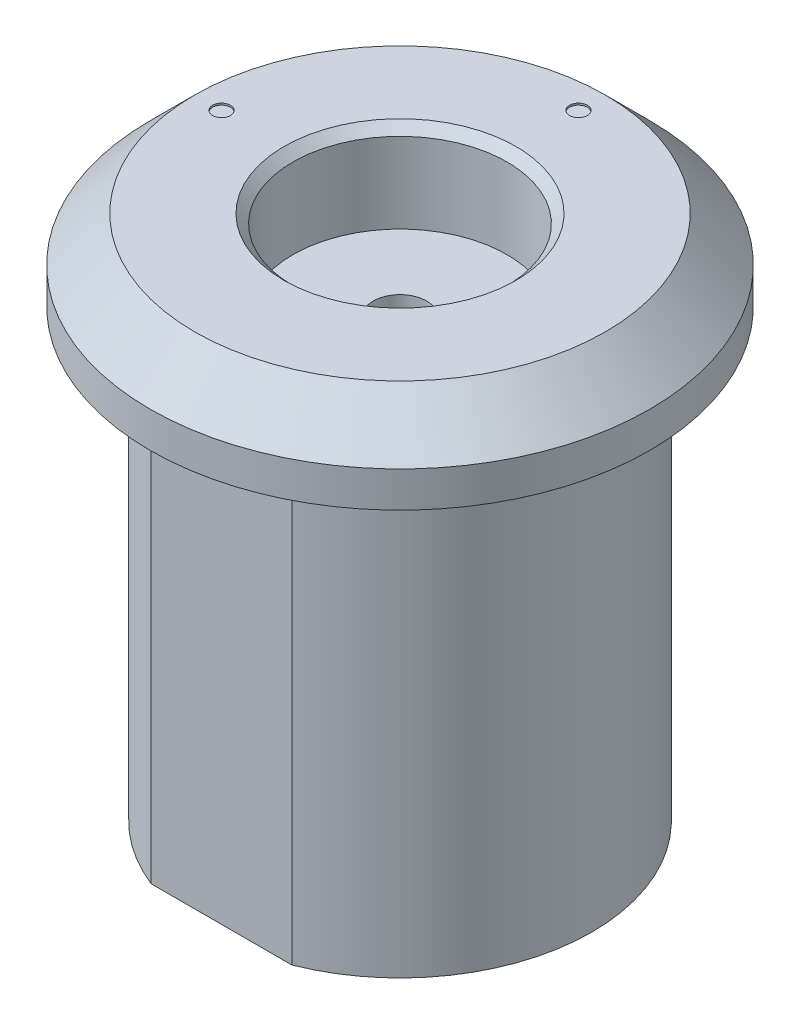
from build123d import *

# Parameters (mm, degrees)
SKETCH_1_R            = 14
EXTRUDE_1_DEPTH       = 4.5
SKETCH_8_R            = 0.5
CUT_EXTRUDE_594_DEPTH = 0.1
CHAMFER_1_SIZE        = 2.5
SKETCH_2_R            = 10.75
EXTRUDE_2_DEPTH       = 25
CUT_EXTRUDE_START     = -25
CUT_EXTRUDE_1_DEPTH   = 25
SKETCH_4_R            = 6
CUT_EXTRUDE_2_DEPTH   = 5
CHAMFER_2_SIZE        = 0.5
SKETCH_6_R            = 8
CUT_EXTRUDE_3_DEPTH   = 20
CUT_EXTRUDE_4_DEPTH   = 32.5


with BuildPart() as part:
    # 草图1 → 凸台-拉伸1 (new body)
    with BuildSketch(Plane(origin=(0, 0, 0), x_dir=(1, 0, 0), z_dir=(0, 1, 0))):
        with Locations(Location((0, 0, 0), (0, 0, 270))):
            Circle(SKETCH_1_R)
    extrude(amount=EXTRUDE_1_DEPTH)

    # 草图8 → Cut-Extrude 594 (cut)
    with BuildSketch(Plane(origin=(0, 4.5, 0), x_dir=(1, 0, 0), z_dir=(0, 1, 0))):
        with Locations(Location((-10, 0, 0), (0, 0, 270))):
            Circle(SKETCH_8_R)
        with Locations(Location((0, 10, 0), (0, 0, 270))):
            Circle(SKETCH_8_R)
    extrude(amount=-CUT_EXTRUDE_594_DEPTH, mode=Mode.SUBTRACT)

    # 倒角1
    chamfer_1_edges = [part.edges().sort_by_distance(p)[0] for p in [
        (0, 4.5, -14),
    ]]
    chamfer(chamfer_1_edges, length=CHAMFER_1_SIZE)

    # 草图2 → 凸台-拉伸2 (add)
    with BuildSketch(Plane.XZ):
        with Locations(Location((0, 0, 0), (0, 0, 90))):
            Circle(SKETCH_2_R)
    extrude(amount=EXTRUDE_2_DEPTH)

    # 草图3 → 切除-拉伸1 (cut)
    with BuildSketch(Plane.XZ.offset(25).offset(CUT_EXTRUDE_START)):
        with BuildLine():
            Line((-3.94493346, -10), (3.94493346, -10))
            ThreePointArc((3.94493346, -10), (0, -10.75), (-3.94493346, -10))
        make_face()
        with BuildLine():
            Line((-3.94493346, 10), (3.94493346, 10))
            ThreePointArc((3.94493346, 10), (0, 10.75), (-3.94493346, 10))
        make_face()
    extrude(amount=CUT_EXTRUDE_1_DEPTH, mode=Mode.SUBTRACT)

    # 草图4 → 切除-拉伸2 (cut)
    with BuildSketch(Plane(origin=(0, 4.5, 0), x_dir=(1, 0, 0), z_dir=(0, 1, 0))):
        with Locations(Location((0, 0, 0), (0, 0, 270))):
            Circle(SKETCH_4_R)
    extrude(amount=-CUT_EXTRUDE_2_DEPTH, mode=Mode.SUBTRACT)

    # 倒角2
    chamfer_2_edges = [part.edges().sort_by_distance(p)[0] for p in [
        (0, 4.5, -6),
    ]]
    chamfer(chamfer_2_edges, length=CHAMFER_2_SIZE)

    # 草图6 → 切除-拉伸3 (cut)
    with BuildSketch(Plane.XZ.offset(25)):
        with Locations(Location((0, 0, 0), (0, 0, 270))):
            Circle(SKETCH_6_R)
    extrude(amount=-CUT_EXTRUDE_3_DEPTH, mode=Mode.SUBTRACT)

    # 草图7 → 切除-拉伸4 (cut, through all)
    with BuildSketch(Plane(origin=(0, -0.5, 0), x_dir=(1, 0, 0), z_dir=(0, 1, 0))):
        with BuildLine():
            Line((0.5, -2), (0.5, -1.414213562))
            ThreePointArc((0.5, -1.414213562), (0, 1.5), (-0.5, -1.414213562))
            Line((-0.5, -1.414213562), (-0.5, -2))
            Line((-0.5, -2), (0.5, -2))
        make_face()
    extrude(amount=-CUT_EXTRUDE_4_DEPTH, mode=Mode.SUBTRACT)


solid = part.part
